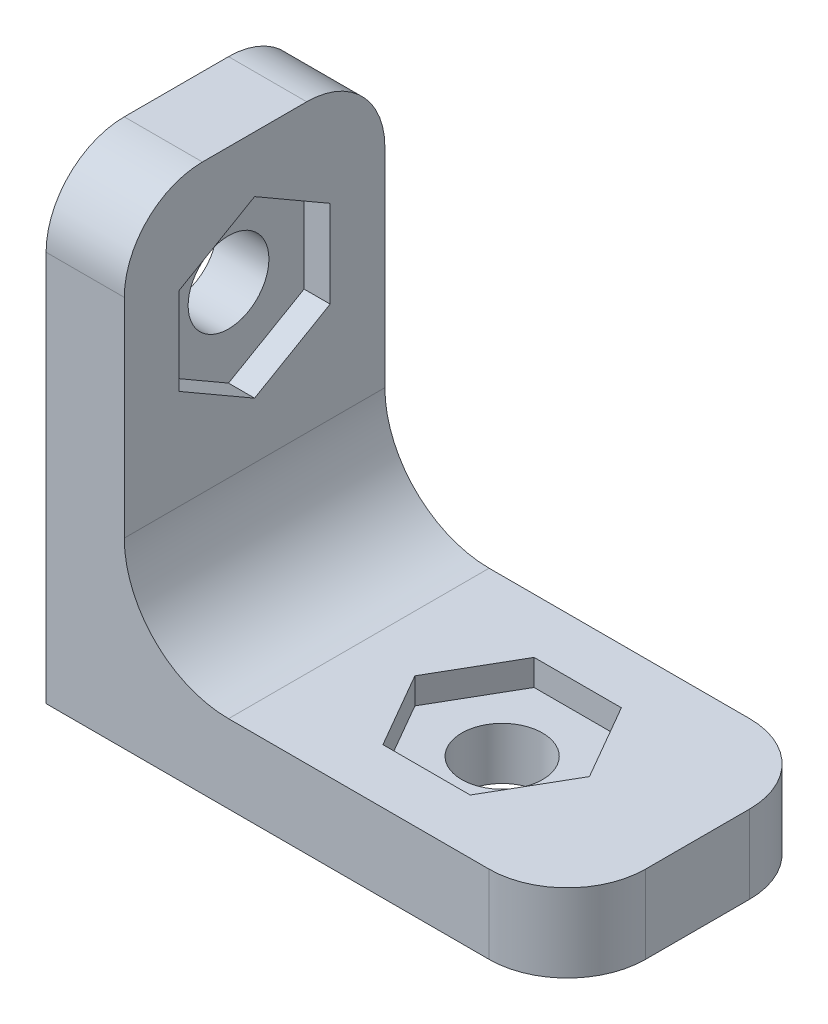
from build123d import *

# Parameters (mm, degrees)
CROQUIS1_W              = 20
CROQUIS1_H              = 10
CROQUIS1_R              = 1.55
SALIENTE_EXTRUIR1_DEPTH = 3
CROQUIS2_W              = 3
CROQUIS2_H              = 10
SALIENTE_EXTRUIR2_DEPTH = 15
CROQUIS3_R              = 1.55
CORTAR_EXTRUIR1_DEPTH   = 3
CORTAR_EXTRUIR3_DEPTH   = 1
REDONDEO1_R             = 3
REDONDEO2_R             = 4
CORTAR_EXTRUIR4_DEPTH   = 1


with BuildPart() as part:
    # Croquis1 → Saliente-Extruir1 (new body)
    with BuildSketch(Plane(origin=(0, 0, 0), x_dir=(1, 0, 0), z_dir=(0, 1, 0))):
        with Locations((10, 5)):
            Rectangle(CROQUIS1_W, CROQUIS1_H)
        with Locations(Location((12.5, 5, 0), (0, 0, 270))):
            Circle(CROQUIS1_R, mode=Mode.SUBTRACT)
    extrude(amount=SALIENTE_EXTRUIR1_DEPTH)

    # Croquis2 → Saliente-Extruir2 (add)
    with BuildSketch(Plane(origin=(0, 3, 0), x_dir=(1, 0, 0), z_dir=(0, 1, 0))):
        with Locations((1.5, 5)):
            Rectangle(CROQUIS2_W, CROQUIS2_H)
    extrude(amount=SALIENTE_EXTRUIR2_DEPTH)

    # Croquis3 → Cortar-Extruir1 (cut)
    with BuildSketch(Plane.ZY):
        with Locations((-5, 12.5)):
            Circle(CROQUIS3_R)
    extrude(amount=-CORTAR_EXTRUIR1_DEPTH, mode=Mode.SUBTRACT)

    # Croquis5 → Cortar-Extruir3 (cut)
    with BuildSketch(Plane(origin=(3, 0, 0), x_dir=(0, 0, -1), z_dir=(1, 0, 0))):
        Polygon((7.9, 14.174315781), (5, 15.848631561), (2.1, 14.174315781), (2.1, 10.825684219), (5, 9.151368439), (7.9, 10.825684219), align=None)
    extrude(amount=-CORTAR_EXTRUIR3_DEPTH, mode=Mode.SUBTRACT)

    # Redondeo1
    redondeo1_edges = [part.edges().sort_by_distance(p)[0] for p in [
        (1.5, 18, 0),
        (1.5, 18, -10),
        (20, 1.5, -10),
        (20, 1.5, 0),
    ]]
    fillet(redondeo1_edges, radius=REDONDEO1_R)

    # Redondeo2
    redondeo2_edges = [part.edges().sort_by_distance(p)[0] for p in [
        (3, 3, -5),
    ]]
    fillet(redondeo2_edges, radius=REDONDEO2_R)

    # Croquis6 → Cortar-Extruir4 (cut)
    with BuildSketch(Plane(origin=(0, 3, 0), x_dir=(1, 0, 0), z_dir=(0, 1, 0))):
        Polygon((14.174315781, 7.9), (10.825684219, 7.9), (9.151368439, 5), (10.825684219, 2.1), (14.174315781, 2.1), (15.848631561, 5), align=None)
    extrude(amount=-CORTAR_EXTRUIR4_DEPTH, mode=Mode.SUBTRACT)


solid = part.part
